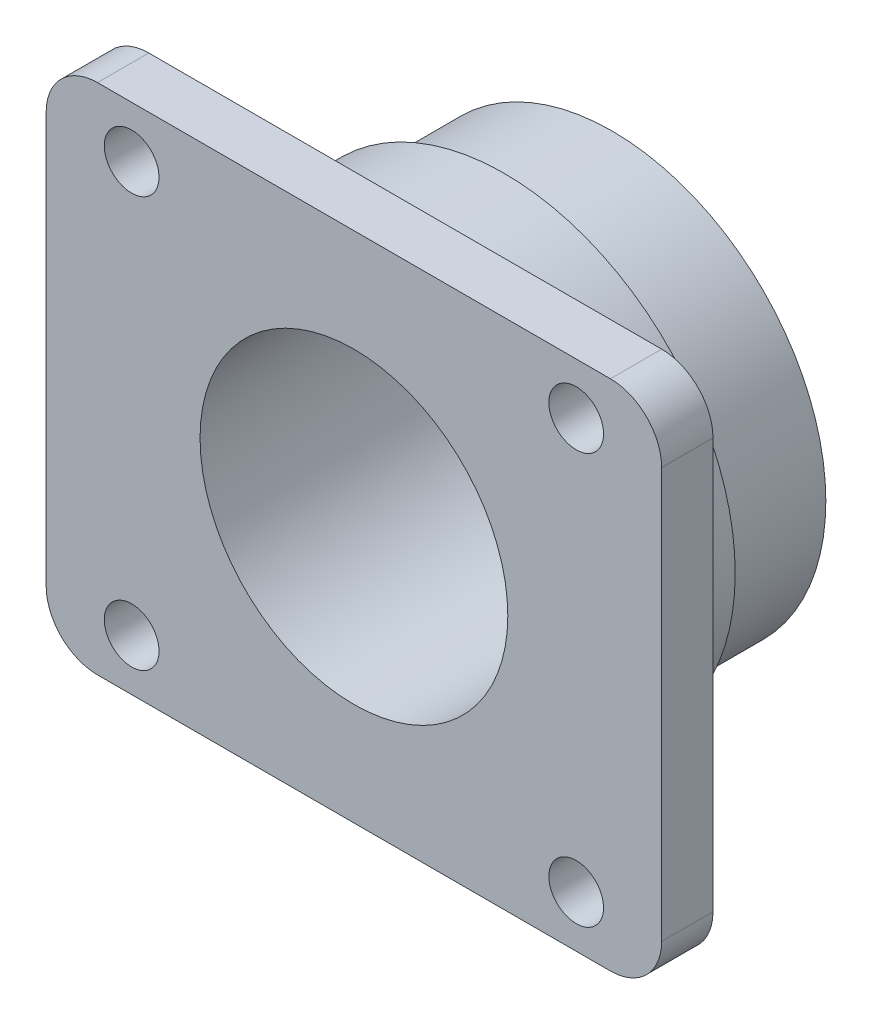
from build123d import *

# Parameters (mm, degrees)
SKETCH_1_R      = 12.5
SKETCH_1_R_2    = 9
EXTRUDE_1_DEPTH = 6.3
SKETCH_2_R      = 13.5
SKETCH_2_R_2    = 9
EXTRUDE_2_DEPTH = 5.8
SKETCH_3_W      = 36
SKETCH_3_H      = 30
SKETCH_3_R      = 9
SKETCH_3_R_2    = 1.6
EXTRUDE_3_DEPTH = 3
FILLET_1_R      = 3


with BuildPart() as part:
    # 草图1 → 凸台-拉伸1 (new body)
    with BuildSketch(Plane.XY):
        Circle(SKETCH_1_R)
        Circle(SKETCH_1_R_2, mode=Mode.SUBTRACT)
    extrude(amount=EXTRUDE_1_DEPTH)

    # 草图2 → 凸台-拉伸2 (add)
    with BuildSketch(Plane.XY.offset(6.3)):
        Circle(SKETCH_2_R)
        Circle(SKETCH_2_R_2, mode=Mode.SUBTRACT)
    extrude(amount=EXTRUDE_2_DEPTH)

    # 草图3 → 凸台-拉伸3 (add)
    with BuildSketch(Plane.XY.offset(12.1)):
        Rectangle(SKETCH_3_W, SKETCH_3_H)
        Circle(SKETCH_3_R, mode=Mode.SUBTRACT)
        with Locations((13, 12)):
            Circle(SKETCH_3_R_2, mode=Mode.SUBTRACT)
        with Locations(Location((13, -12, 0), (0, 0, 180))):
            Circle(SKETCH_3_R_2, mode=Mode.SUBTRACT)
        with Locations((-13, -12)):
            Circle(SKETCH_3_R_2, mode=Mode.SUBTRACT)
        with Locations(Location((-13, 12, 0), (0, 0, 180))):
            Circle(SKETCH_3_R_2, mode=Mode.SUBTRACT)
    extrude(amount=EXTRUDE_3_DEPTH)

    # 圆角1
    fillet_1_edges = [part.edges().sort_by_distance(p)[0] for p in [
        (18, 15, 13.6),
        (-18, 15, 13.6),
        (-18, -15, 13.6),
        (18, -15, 13.6),
    ]]
    fillet(fillet_1_edges, radius=FILLET_1_R)


solid = part.part
